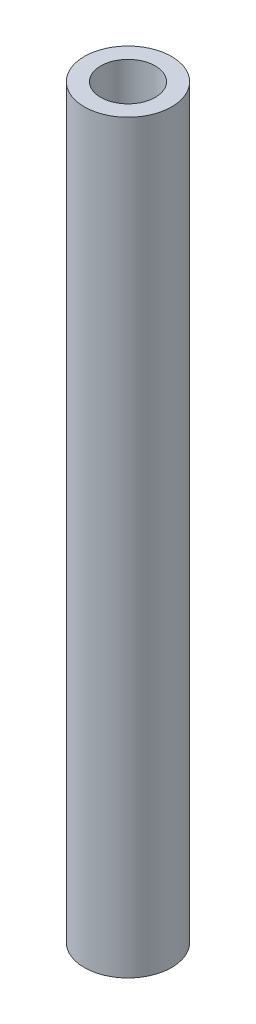
from build123d import *

# Parameters (mm, degrees)
SZKIC1_R                    = 4
SZKIC1_R_2                  = 2.5
DODANIE_WYCI_GNI_CIE1_DEPTH = 68.3


with BuildPart() as part:
    # Szkic1 → Dodanie-wyciągnięcie1 (new body)
    with BuildSketch(Plane(origin=(0, 0, 0), x_dir=(1, 0, 0), z_dir=(0, 1, 0))):
        with Locations(Location((-3.443725343, 0, 0), (0, 0, 270))):
            Circle(SZKIC1_R)
        with Locations(Location((-3.443725343, 0, 0), (0, 0, 270))):
            Circle(SZKIC1_R_2, mode=Mode.SUBTRACT)
    extrude(amount=DODANIE_WYCI_GNI_CIE1_DEPTH)


solid = part.part
